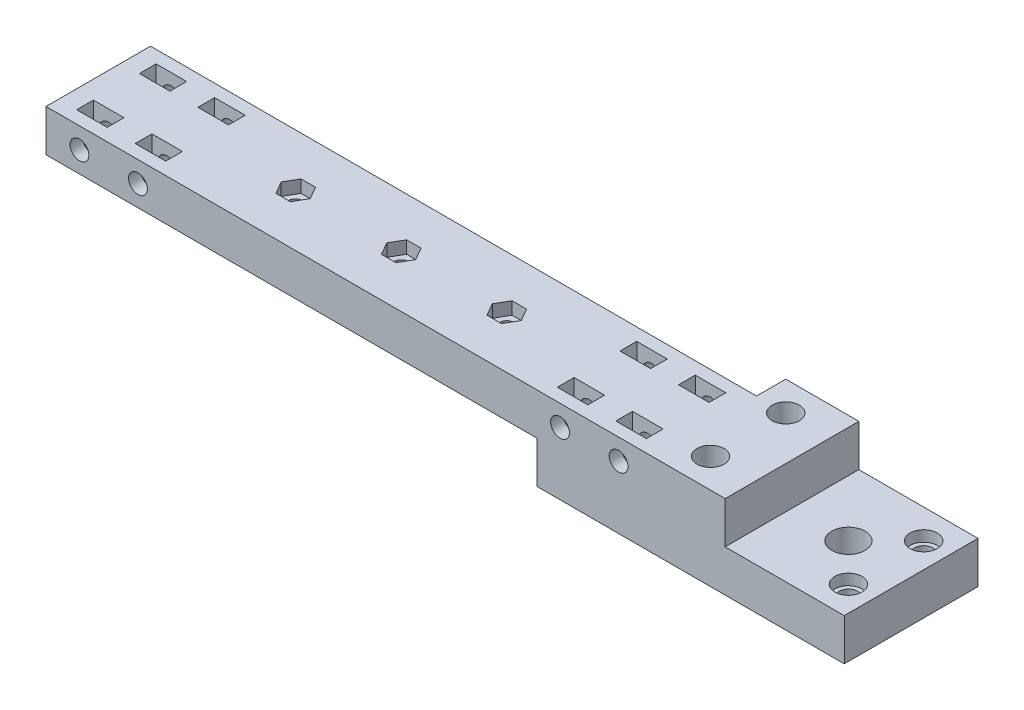
from build123d import *

# Parameters (mm, degrees)
SKETCH1_W           = 145
SKETCH1_H           = 25
BOSS_EXTRUDE1_DEPTH = 10
SKETCH2_W           = 17.5
SKETCH2_H           = 32
BOSS_EXTRUDE2_DEPTH = 10
SKETCH4_W           = 73.5
SKETCH4_H           = 32
BOSS_EXTRUDE3_DEPTH = 10
CUT_EXTRUDE1_REACH  = 196.692
SKETCH5_R           = 2.25
SKETCH6_R           = 4.2
CUT_EXTRUDE2_DEPTH  = 2.4
CUT_EXTRUDE4_REACH  = 201.46
CUT_EXTRUDE4_START  = -5
SKETCH7_R           = 3.25
SKETCH8_R           = 2.25
CUT_EXTRUDE5_DEPTH  = 193.888568868
SKETCH9_W           = 7.3
SKETCH9_H           = 4
CUT_EXTRUDE6_DEPTH  = 10
CUT_EXTRUDE7_REACH  = 195.92
SKETCH10_R          = 4
SKETCH11_R          = 7
CUT_EXTRUDE8_DEPTH  = 2.5
CUT_EXTRUDE9_REACH  = 196.692
SKETCH12_R          = 1.75
CUT_EXTRUDE10_DEPTH = 3


with BuildPart() as part:
    # Sketch1 → Boss-Extrude1 (new body)
    with BuildSketch(Plane(origin=(0, 0, 0), x_dir=(1, 0, 0), z_dir=(0, 1, 0))):
        with Locations((72.5, 12.5)):
            Rectangle(SKETCH1_W, SKETCH1_H)
    extrude(amount=BOSS_EXTRUDE1_DEPTH)

    # Sketch2 → Boss-Extrude2 (add)
    with BuildSketch(Plane(origin=(0, 10, 0), x_dir=(1, 0, 0), z_dir=(0, 1, 0))):
        with Locations((153.75, 16)):
            Rectangle(SKETCH2_W, SKETCH2_H)
    extrude(amount=-BOSS_EXTRUDE2_DEPTH)

    # Sketch4 → Boss-Extrude3 (add)
    with BuildSketch(Plane.XZ):
        with Locations((154.25, -16)):
            Rectangle(SKETCH4_W, SKETCH4_H)
    extrude(amount=BOSS_EXTRUDE3_DEPTH)

    # Sketch5 → Cut-Extrude1 (cut, up to next)
    with BuildSketch(Plane.XZ.offset(10), mode=Mode.PRIVATE) as cut_extrude1_sk1:
        with Locations(Location((185, -7, 0), (0, 0, 270))):
            Circle(SKETCH5_R)
    cut_extrude1_tool1 = extrude(cut_extrude1_sk1.sketch, amount=-CUT_EXTRUDE1_REACH, mode=Mode.PRIVATE) & part.part
    # Sketch5 → Cut-Extrude1 (cut, up to next)
    with BuildSketch(Plane.XZ.offset(10), mode=Mode.PRIVATE) as cut_extrude1_sk2:
        with Locations(Location((152, -7, 0), (0, 0, 270))):
            Circle(SKETCH5_R)
    cut_extrude1_tool2 = extrude(cut_extrude1_sk2.sketch, amount=-CUT_EXTRUDE1_REACH, mode=Mode.PRIVATE) & part.part
    # Sketch5 → Cut-Extrude1 (cut, up to next)
    with BuildSketch(Plane.XZ.offset(10), mode=Mode.PRIVATE) as cut_extrude1_sk3:
        with Locations(Location((185, -25, 0), (0, 0, 270))):
            Circle(SKETCH5_R)
    cut_extrude1_tool3 = extrude(cut_extrude1_sk3.sketch, amount=-CUT_EXTRUDE1_REACH, mode=Mode.PRIVATE) & part.part
    # Sketch5 → Cut-Extrude1 (cut, up to next)
    with BuildSketch(Plane.XZ.offset(10), mode=Mode.PRIVATE) as cut_extrude1_sk4:
        with Locations(Location((152, -25, 0), (0, 0, 90))):
            Circle(SKETCH5_R)
    cut_extrude1_tool4 = extrude(cut_extrude1_sk4.sketch, amount=-CUT_EXTRUDE1_REACH, mode=Mode.PRIVATE) & part.part
    add(cut_extrude1_tool1.solids().sort_by_distance((185, -10, -7))[0], mode=Mode.SUBTRACT)
    add(cut_extrude1_tool2.solids().sort_by_distance((152, -10, -7))[0], mode=Mode.SUBTRACT)
    add(cut_extrude1_tool3.solids().sort_by_distance((185, -10, -25))[0], mode=Mode.SUBTRACT)
    add(cut_extrude1_tool4.solids().sort_by_distance((152, -10, -25))[0], mode=Mode.SUBTRACT)

    # Sketch6 → Cut-Extrude2 (cut)
    with BuildSketch(Plane.XZ.offset(10)):
        with Locations(Location((152, -7, 0), (0, 0, 270))):
            Circle(SKETCH6_R)
        with Locations(Location((185, -7, 0), (0, 0, 270))):
            Circle(SKETCH6_R)
        with Locations(Location((185, -25, 0), (0, 0, 90))):
            Circle(SKETCH6_R)
        with Locations(Location((152, -25, 0), (0, 0, 90))):
            Circle(SKETCH6_R)
    extrude(amount=-CUT_EXTRUDE2_DEPTH, mode=Mode.SUBTRACT)

    # Sketch7 → Cut-Extrude4 (cut, up to next)
    with BuildSketch(Plane.XZ.offset(7.6).offset(CUT_EXTRUDE4_START), mode=Mode.PRIVATE) as cut_extrude4_sk1:
        with Locations(Location((152, -7, 0), (0, 0, 270))):
            Circle(SKETCH7_R)
    cut_extrude4_tool1 = extrude(cut_extrude4_sk1.sketch, amount=-CUT_EXTRUDE4_REACH, mode=Mode.PRIVATE) & part.part
    # Sketch7 → Cut-Extrude4 (cut, up to next)
    with BuildSketch(Plane.XZ.offset(7.6).offset(CUT_EXTRUDE4_START), mode=Mode.PRIVATE) as cut_extrude4_sk2:
        with Locations(Location((185, -7, 0), (0, 0, 270))):
            Circle(SKETCH7_R)
    cut_extrude4_tool2 = extrude(cut_extrude4_sk2.sketch, amount=-CUT_EXTRUDE4_REACH, mode=Mode.PRIVATE) & part.part
    # Sketch7 → Cut-Extrude4 (cut, up to next)
    with BuildSketch(Plane.XZ.offset(7.6).offset(CUT_EXTRUDE4_START), mode=Mode.PRIVATE) as cut_extrude4_sk3:
        with Locations(Location((185, -25, 0), (0, 0, 270))):
            Circle(SKETCH7_R)
    cut_extrude4_tool3 = extrude(cut_extrude4_sk3.sketch, amount=-CUT_EXTRUDE4_REACH, mode=Mode.PRIVATE) & part.part
    # Sketch7 → Cut-Extrude4 (cut, up to next)
    with BuildSketch(Plane.XZ.offset(7.6).offset(CUT_EXTRUDE4_START), mode=Mode.PRIVATE) as cut_extrude4_sk4:
        with Locations(Location((152, -25, 0), (0, 0, 90))):
            Circle(SKETCH7_R)
    cut_extrude4_tool4 = extrude(cut_extrude4_sk4.sketch, amount=-CUT_EXTRUDE4_REACH, mode=Mode.PRIVATE) & part.part
    add(cut_extrude4_tool1.solids().sort_by_distance((152, -2.6, -7))[0], mode=Mode.SUBTRACT)
    add(cut_extrude4_tool2.solids().sort_by_distance((185, -2.6, -7))[0], mode=Mode.SUBTRACT)
    add(cut_extrude4_tool3.solids().sort_by_distance((185, -2.6, -25))[0], mode=Mode.SUBTRACT)
    add(cut_extrude4_tool4.solids().sort_by_distance((152, -2.6, -25))[0], mode=Mode.SUBTRACT)

    # Sketch8 → Cut-Extrude5 (cut, through all)
    with BuildSketch(Plane(origin=(0, 0, -25), x_dir=(-1, 0, 0), z_dir=(0, 0, -1))):
        with Locations((-137, 5)):
            Circle(SKETCH8_R)
        with Locations((-123, 5)):
            Circle(SKETCH8_R)
        with Locations(Location((-22, 5, 0), (0, 0, 180))):
            Circle(SKETCH8_R)
        with Locations(Location((-8, 5, 0), (0, 0, 180))):
            Circle(SKETCH8_R)
    extrude(amount=-CUT_EXTRUDE5_DEPTH, mode=Mode.SUBTRACT)

    # Sketch9 → Cut-Extrude6 (cut)
    with BuildSketch(Plane(origin=(0, 10, 0), x_dir=(1, 0, 0), z_dir=(0, 1, 0))):
        with Locations((137, 20)):
            Rectangle(SKETCH9_W, SKETCH9_H)
        with Locations((137, 5)):
            Rectangle(SKETCH9_W, SKETCH9_H)
        with Locations((123, 5)):
            Rectangle(SKETCH9_W, SKETCH9_H)
        with Locations((123, 20)):
            Rectangle(SKETCH9_W, SKETCH9_H)
        with Locations((8, 20)):
            Rectangle(SKETCH9_W, SKETCH9_H)
        with Locations((22, 20)):
            Rectangle(SKETCH9_W, SKETCH9_H)
        with Locations((22, 5)):
            Rectangle(SKETCH9_W, SKETCH9_H)
        with Locations((8, 5)):
            Rectangle(SKETCH9_W, SKETCH9_H)
    extrude(amount=-CUT_EXTRUDE6_DEPTH, mode=Mode.SUBTRACT)

    # Sketch10 → Cut-Extrude7 (cut, up to next)
    with BuildSketch(Plane(origin=(0, 0, 0), x_dir=(1, 0, 0), z_dir=(0, 1, 0)), mode=Mode.PRIVATE) as cut_extrude7_sk1:
        with Locations(Location((176, 16, 0), (0, 0, 270))):
            Circle(SKETCH10_R)
    cut_extrude7_tool1 = extrude(cut_extrude7_sk1.sketch, amount=-CUT_EXTRUDE7_REACH, mode=Mode.PRIVATE) & part.part
    add(cut_extrude7_tool1.solids().sort_by_distance((176, 0, -16))[0], mode=Mode.SUBTRACT)

    # Sketch11 → Cut-Extrude8 (cut)
    with BuildSketch(Plane.XZ.offset(10)):
        with Locations(Location((176, -16, 0), (0, 0, 270))):
            Circle(SKETCH11_R)
        with BuildLine():
            Line((160.5, -21.5), (160.5, -10.5))
            ThreePointArc((160.5, -10.5), (163.5, -7.5), (166.5, -10.5))
            Line((166.5, -10.5), (166.5, -21.5))
            ThreePointArc((166.5, -21.5), (163.5, -24.5), (160.5, -21.5))
        make_face()
    extrude(amount=-CUT_EXTRUDE8_DEPTH, mode=Mode.SUBTRACT)

    # Sketch12 → Cut-Extrude9 (cut, up to next)
    with BuildSketch(Plane(origin=(0, 10, 0), x_dir=(1, 0, 0), z_dir=(0, 1, 0)), mode=Mode.PRIVATE) as cut_extrude9_sk1:
        with Locations(Location((47.25, 12.5, 0), (0, 0, 270))):
            Circle(SKETCH12_R)
    cut_extrude9_tool1 = extrude(cut_extrude9_sk1.sketch, amount=-CUT_EXTRUDE9_REACH, mode=Mode.PRIVATE) & part.part
    # Sketch12 → Cut-Extrude9 (cut, up to next)
    with BuildSketch(Plane(origin=(0, 10, 0), x_dir=(1, 0, 0), z_dir=(0, 1, 0)), mode=Mode.PRIVATE) as cut_extrude9_sk2:
        with Locations(Location((72.5, 12.5, 0), (0, 0, 270))):
            Circle(SKETCH12_R)
    cut_extrude9_tool2 = extrude(cut_extrude9_sk2.sketch, amount=-CUT_EXTRUDE9_REACH, mode=Mode.PRIVATE) & part.part
    # Sketch12 → Cut-Extrude9 (cut, up to next)
    with BuildSketch(Plane(origin=(0, 10, 0), x_dir=(1, 0, 0), z_dir=(0, 1, 0)), mode=Mode.PRIVATE) as cut_extrude9_sk3:
        with Locations(Location((97.75, 12.5, 0), (0, 0, 270))):
            Circle(SKETCH12_R)
    cut_extrude9_tool3 = extrude(cut_extrude9_sk3.sketch, amount=-CUT_EXTRUDE9_REACH, mode=Mode.PRIVATE) & part.part
    add(cut_extrude9_tool1.solids().sort_by_distance((47.25, 10, -12.5))[0], mode=Mode.SUBTRACT)
    add(cut_extrude9_tool2.solids().sort_by_distance((72.5, 10, -12.5))[0], mode=Mode.SUBTRACT)
    add(cut_extrude9_tool3.solids().sort_by_distance((97.75, 10, -12.5))[0], mode=Mode.SUBTRACT)

    # Sketch13 → Cut-Extrude10 (cut)
    with BuildSketch(Plane(origin=(0, 10, 0), x_dir=(1, 0, 0), z_dir=(0, 1, 0))):
        Polygon((75.964101615, 12.5), (74.232050808, 15.5), (70.767949192, 15.5), (69.035898385, 12.5), (70.767949192, 9.5), (74.232050808, 9.5), align=None)
        Polygon((50.714101615, 12.5), (48.982050808, 15.5), (45.517949192, 15.5), (43.785898385, 12.5), (45.517949192, 9.5), (48.982050808, 9.5), align=None)
        Polygon((101.214101615, 12.5), (99.482050808, 15.5), (96.017949192, 15.5), (94.285898385, 12.5), (96.017949192, 9.5), (99.482050808, 9.5), align=None)
    extrude(amount=-CUT_EXTRUDE10_DEPTH, mode=Mode.SUBTRACT)


solid = part.part
